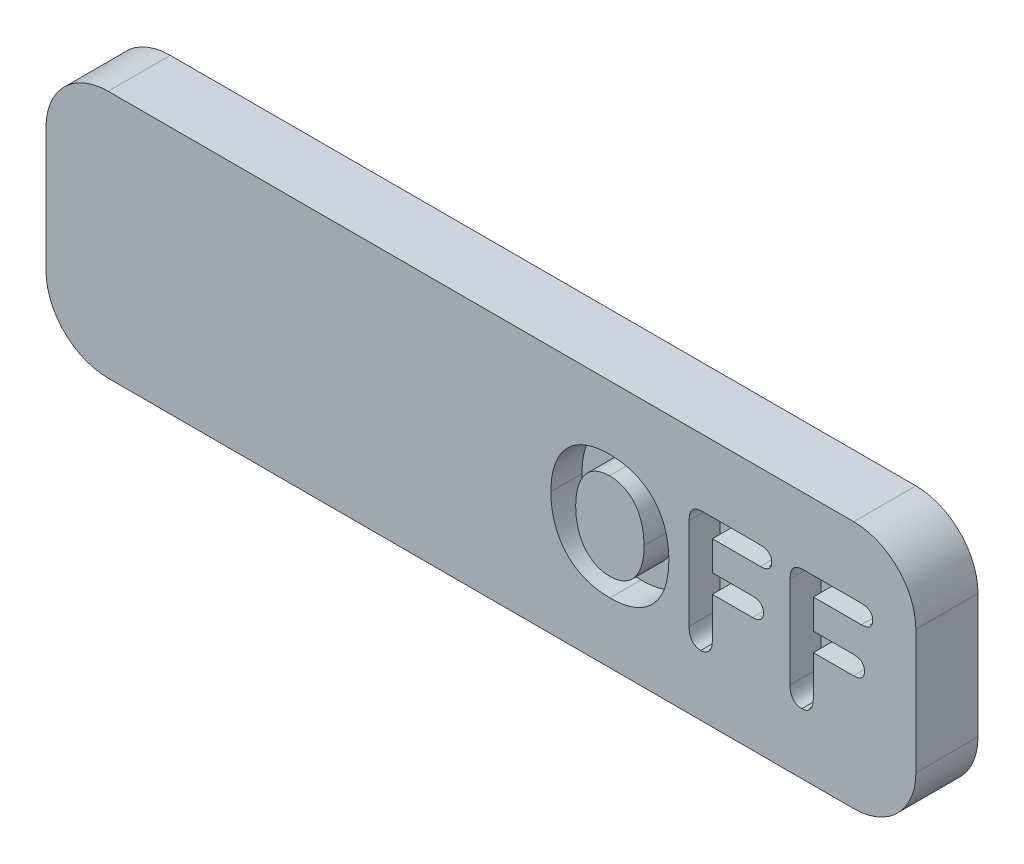
from build123d import *

# Parameters (mm, degrees)
AUFSATZ_LINEAR_AUSTRAGEN1_DEPTH = 1
SCHNITT_LINEAR_AUSTRAGEN1_DEPTH = 0.5


with BuildPart() as part:
    # Skizze1 → Aufsatz-Linear austragen1 (new body)
    with BuildSketch(Plane.XY):
        with BuildLine():
            Line((1, 0), (13, 0))
            ThreePointArc((13, 0), (13.707106781, 0.292893219), (14, 1))
            Line((14, 1), (14, 3))
            ThreePointArc((14, 3), (13.707106781, 3.707106781), (13, 4))
            Line((13, 4), (1, 4))
            ThreePointArc((1, 4), (0.292893219, 3.707106781), (0, 3))
            Line((0, 3), (0, 1))
            ThreePointArc((0, 1), (0.292893219, 0.292893219), (1, 0))
        make_face()
    extrude(amount=AUFSATZ_LINEAR_AUSTRAGEN1_DEPTH)

    # Skizze2 → Schnitt-Linear austragen1 (cut)
    # profile 1 of 3: a face of its own
    with BuildSketch(Plane.XY.offset(1)):
        with BuildLine():
            add(Edge.make_bspline(
                [(9.068359375, 2.975), (9.093112394, 2.974652516), (9.14164836, 2.973971167), (9.213088792, 2.96779492), (9.281989676, 2.95862748), (9.348304365, 2.945431971), (9.411868349, 2.928213747), (9.472693733, 2.90705225), (9.530858895, 2.882017573), (9.586431863, 2.853600887), (9.638802164, 2.821433292), (9.688303235, 2.786256364), (9.73437439, 2.747554036), (9.77712302, 2.705666037), (9.816276383, 2.660478074), (9.852403686, 2.612241049), (9.885226635, 2.56068362), (9.914391718, 2.505816744), (9.940594574, 2.44846024), (9.963340406, 2.388446006), (9.982324979, 2.326028293), (9.998116048, 2.26110371), (10.010084082, 2.193767278), (10.018514176, 2.123861297), (10.024350356, 2.051661497), (10.024781349, 2.002616087), (10.025, 1.977734375)],
                knots=[0, 0, 0, 0, 1.137132438, 2.22970057, 3.292424762, 4.329649132, 5.333981859, 6.315987487, 7.286185149, 8.241436353, 9.181332131, 10.107725602, 11.0292572, 11.943085262, 12.854854597, 13.773819033, 14.709898734, 15.660115542, 16.626635295, 17.605574315, 18.606712189, 19.622473761, 20.67399022, 21.747038223, 22.857027702, 24, 24, 24, 24], degree=3))
            add(Edge.make_bspline(
                [(10.025, 1.977734375), (10.024236943, 1.941248344), (10.022739737, 1.869658489), (10.011382941, 1.76485224), (9.992130943, 1.66508578), (9.965911152, 1.570399581), (9.931448688, 1.481449161), (9.889521373, 1.398351336), (9.839716722, 1.321507209), (9.782571307, 1.250986245), (9.718303636, 1.18718792), (9.646474639, 1.13157047), (9.567529745, 1.084100864), (9.48217021, 1.044116269), (9.38988477, 1.012613038), (9.290860282, 0.991433257), (9.185708374, 0.977018048), (9.11333274, 0.975684634), (9.076171875, 0.975)],
                knots=[0, 0, 0, 0, 1.119700056, 2.196982321, 3.230778928, 4.235358115, 5.208318876, 6.153781848, 7.087131445, 8.013361148, 8.934611457, 9.860297843, 10.794468433, 11.756326826, 12.748403726, 13.780058436, 14.860183413, 16, 16, 16, 16], degree=3))
            add(Edge.make_bspline(
                [(9.076171875, 0.975), (9.03927875, 0.975888232), (8.967053764, 0.977627108), (8.861766869, 0.991561146), (8.762215291, 1.013976035), (8.668967416, 1.04602514), (8.582674595, 1.08683826), (8.502975001, 1.134344554), (8.431414901, 1.190464862), (8.367075118, 1.253597267), (8.309960779, 1.323841341), (8.261404629, 1.401545242), (8.218582067, 1.485017774), (8.184733705, 1.575497068), (8.157803717, 1.671020204), (8.13882396, 1.770875151), (8.127251689, 1.874465923), (8.125758488, 1.944761386), (8.125, 1.98046875)],
                knots=[0, 0, 0, 0, 1.130091603, 2.212359386, 3.247930852, 4.252250901, 5.226719473, 6.16821431, 7.089197795, 8.00610207, 8.925165125, 9.855999165, 10.808795857, 11.79501972, 12.810514548, 13.846493258, 14.906102224, 16, 16, 16, 16], degree=3))
            add(Edge.make_bspline(
                [(8.125, 1.98046875), (8.125688028, 2.016832883), (8.127040936, 2.088337779), (8.139531744, 2.193099625), (8.15925301, 2.293397724), (8.187362441, 2.388727145), (8.223002781, 2.478418194), (8.266262664, 2.561492737), (8.316348518, 2.637693274), (8.373591781, 2.70687478), (8.438083357, 2.768616063), (8.509462446, 2.82261175), (8.587377693, 2.86905948), (8.671832678, 2.907263474), (8.762443164, 2.937927219), (8.859185583, 2.959576748), (8.961878055, 2.97269235), (9.032251673, 2.974217478), (9.068359375, 2.975)],
                knots=[0, 0, 0, 0, 1.125218611, 2.212582392, 3.260701818, 4.286054269, 5.284468473, 6.243521648, 7.180287843, 8.101949555, 9.017004541, 9.937572836, 10.866572707, 11.818894766, 12.801573564, 13.82236102, 14.882684417, 16, 16, 16, 16], degree=3))
        make_face()
        with BuildLine():
            add(Edge.make_bspline(
                [(9.625, 1.98046875), (9.624236115, 2.015277472), (9.622757058, 2.082675226), (9.609648511, 2.180171038), (9.588416712, 2.27060321), (9.563111057, 2.340625009), (9.538811369, 2.392528468), (9.51896586, 2.42865343), (9.497617935, 2.462663361), (9.473388511, 2.493425176), (9.448255174, 2.522406317), (9.421043849, 2.54892338), (9.391707134, 2.572581535), (9.350596581, 2.601296683), (9.295234429, 2.631050621), (9.223753123, 2.656546627), (9.147556711, 2.672258276), (9.09512819, 2.674073293), (9.068359375, 2.675)],
                knots=[0, 0, 0, 0, 1.663767962, 3.22144036, 4.693807908, 6.09809827, 6.772124886, 7.43249818, 8.068074837, 8.689496673, 9.30272399, 9.901527182, 10.503429657, 11.102750509, 12.297797107, 13.495176895, 14.721094103, 16, 16, 16, 16], degree=3))
            add(Edge.make_bspline(
                [(9.068359375, 2.675), (9.04918449, 2.674523021), (9.011287158, 2.673580316), (8.955655243, 2.664627547), (8.902215528, 2.650626376), (8.851216647, 2.631043473), (8.803112784, 2.606035103), (8.758119138, 2.575673263), (8.716778265, 2.540076152), (8.678858763, 2.499387916), (8.64458724, 2.453198562), (8.614182017, 2.401028966), (8.587690016, 2.342878426), (8.565104568, 2.279265806), (8.547241689, 2.210518214), (8.534540277, 2.137356433), (8.526561269, 2.060201883), (8.525528163, 2.007441739), (8.525, 1.98046875)],
                knots=[0, 0, 0, 0, 0.926902171, 1.831933723, 2.71800685, 3.595261319, 4.468550136, 5.334998465, 6.214894287, 7.1017058, 8.020008637, 8.99111482, 10.01694856, 11.106630737, 12.25237115, 13.448355624, 14.695502513, 16, 16, 16, 16], degree=3))
            add(Edge.make_bspline(
                [(8.525, 1.98046875), (8.525529621, 1.953235833), (8.526565779, 1.899956987), (8.534528502, 1.822019496), (8.547312827, 1.74796955), (8.565048146, 1.678113625), (8.58799262, 1.613266121), (8.615536195, 1.554021234), (8.646413772, 1.499956378), (8.682840272, 1.452579062), (8.722186978, 1.410770889), (8.76447307, 1.374356244), (8.809393417, 1.343334803), (8.857378179, 1.318080366), (8.908164293, 1.299131658), (8.961190349, 1.284770984), (9.016800589, 1.276568573), (9.054661701, 1.275527183), (9.073828125, 1.275)],
                knots=[0, 0, 0, 0, 1.300369924, 2.54406124, 3.737115199, 4.88637188, 5.981883645, 7.016846829, 8.003376514, 8.948590554, 9.863559023, 10.741055788, 11.608647785, 12.46534091, 13.323432129, 14.192248925, 15.0848625, 16, 16, 16, 16], degree=3))
            add(Edge.make_bspline(
                [(9.073828125, 1.275), (9.098514049, 1.275826804), (9.147153697, 1.277455889), (9.218375005, 1.292666561), (9.286422084, 1.316581814), (9.340300617, 1.34411813), (9.380907534, 1.371243102), (9.410251531, 1.394127245), (9.437531132, 1.420168305), (9.463533565, 1.448361043), (9.487628227, 1.479320201), (9.510440944, 1.51265316), (9.531503359, 1.54871627), (9.550989754, 1.587307904), (9.568587312, 1.628357856), (9.583936454, 1.67175711), (9.596172475, 1.717696454), (9.606851743, 1.765749251), (9.614975974, 1.816231574), (9.620753103, 1.868901619), (9.624372846, 1.923907557), (9.624787704, 1.961322387), (9.625, 1.98046875)],
                knots=[0, 0, 0, 0, 1.468568495, 2.893578421, 4.316075305, 5.755382189, 6.482330971, 7.222315454, 7.968369796, 8.725783183, 9.504530818, 10.302500265, 11.129737207, 11.9897977, 12.875655565, 13.787998707, 14.728608307, 15.705132475, 16.718642732, 17.771954593, 18.859838044, 20, 20, 20, 20], degree=3))
        make_face(mode=Mode.SUBTRACT)
    # profile 2 of 3: a face of its own
    with BuildSketch(Plane.XY.offset(1)):
        with BuildLine():
            Line((11.496484375, 2.625), (10.725, 2.625))
            Line((10.725, 2.625), (10.725, 2.15))
            Line((10.725, 2.15), (11.369921875, 2.15))
            add(Edge.make_bspline(
                [(11.369921875, 2.15), (11.383883271, 2.14945879), (11.410203576, 2.148438491), (11.447110821, 2.141389144), (11.47840524, 2.128371341), (11.504035903, 2.110243318), (11.523463113, 2.087261174), (11.537856979, 2.061180563), (11.546289753, 2.031234647), (11.547187079, 2.010211048), (11.54765625, 1.99921875)],
                knots=[0, 0, 0, 0, 1.26669481, 2.387998457, 3.388485007, 4.319542635, 5.207485584, 6.095585677, 7.004267047, 8, 8, 8, 8], degree=3))
            add(Edge.make_bspline(
                [(11.54765625, 1.99921875), (11.547225036, 1.988341658), (11.546394154, 1.967383214), (11.53731942, 1.937748985), (11.523249102, 1.911450225), (11.503180899, 1.889110295), (11.47762874, 1.871144254), (11.446294386, 1.858913112), (11.40990744, 1.850884055), (11.383773158, 1.850306243), (11.369921875, 1.85)],
                knots=[0, 0, 0, 0, 0.989228558, 1.906087716, 2.798941975, 3.690531566, 4.619691956, 5.620966574, 6.739101907, 8, 8, 8, 8], degree=3))
            Line((11.369921875, 1.85), (10.725, 1.85))
            Line((10.725, 1.85), (10.725, 1.213671875))
            add(Edge.make_bspline(
                [(10.725, 1.213671875), (10.724507022, 1.194743935), (10.723577977, 1.159073102), (10.714003189, 1.109381119), (10.697818889, 1.067102991), (10.674221588, 1.033239862), (10.645873511, 1.006936107), (10.613099687, 0.988678385), (10.577002457, 0.976625506), (10.551401537, 0.975550786), (10.53828125, 0.975)],
                knots=[0, 0, 0, 0, 1.324745361, 2.496561692, 3.52818871, 4.472071426, 5.363073267, 6.212819431, 7.084082786, 8, 8, 8, 8], degree=3))
            add(Edge.make_bspline(
                [(10.53828125, 0.975), (10.524898438, 0.975537353), (10.498908347, 0.97658092), (10.462322489, 0.988691755), (10.429172604, 1.006807308), (10.400823857, 1.033266589), (10.377052726, 1.067005945), (10.361814323, 1.109182644), (10.351161808, 1.15793295), (10.350403718, 1.193028678), (10.35, 1.21171875)],
                knots=[0, 0, 0, 0, 0.935462148, 1.816714299, 2.675664794, 3.567975675, 4.513245122, 5.543029804, 6.691551627, 8, 8, 8, 8], degree=3))
            Line((10.35, 1.21171875), (10.35, 2.687109375))
            add(Edge.make_bspline(
                [(10.35, 2.687109375), (10.350303969, 2.700402832), (10.350883848, 2.725762591), (10.355120221, 2.762019314), (10.362274965, 2.794479223), (10.372904114, 2.823173536), (10.386761337, 2.848253735), (10.403797605, 2.870134329), (10.425248409, 2.887380518), (10.449323701, 2.901829451), (10.477228128, 2.912064534), (10.508196329, 2.920067086), (10.542867304, 2.924052122), (10.567049713, 2.92467466), (10.5796875, 2.925)],
                knots=[0, 0, 0, 0, 1.248307341, 2.381380143, 3.422634109, 4.362988604, 5.244318775, 6.105654139, 6.948029729, 7.814212849, 8.731706968, 9.728269157, 10.812787817, 12, 12, 12, 12], degree=3))
            Line((10.5796875, 2.925), (11.496484375, 2.925))
            add(Edge.make_bspline(
                [(11.496484375, 2.925), (11.511092234, 2.92445922), (11.538439133, 2.923446843), (11.576855611, 2.916484187), (11.609045432, 2.903005621), (11.635633047, 2.884905722), (11.655629615, 2.862131446), (11.670819949, 2.836454099), (11.679453653, 2.807048707), (11.680382788, 2.786381969), (11.680859375, 2.77578125)],
                knots=[0, 0, 0, 0, 1.306215152, 2.44532304, 3.467849054, 4.404266228, 5.294549162, 6.155037916, 7.053652051, 8, 8, 8, 8], degree=3))
            add(Edge.make_bspline(
                [(11.680859375, 2.77578125), (11.680401401, 2.764914553), (11.679513686, 2.74385102), (11.670702961, 2.713899719), (11.655888245, 2.687581141), (11.635591812, 2.664748454), (11.60914249, 2.646514501), (11.576747722, 2.633642883), (11.538457102, 2.62651146), (11.51109849, 2.625526262), (11.496484375, 2.625)],
                knots=[0, 0, 0, 0, 0.963504472, 1.867615256, 2.742849562, 3.627587234, 4.558171791, 5.569908026, 6.701920807, 8, 8, 8, 8], degree=3))
        make_face()
    # profile 3 of 3: a face of its own
    with BuildSketch(Plane.XY.offset(1)):
        with BuildLine():
            Line((13.121484375, 2.625), (12.35, 2.625))
            Line((12.35, 2.625), (12.35, 2.15))
            Line((12.35, 2.15), (12.994921875, 2.15))
            add(Edge.make_bspline(
                [(12.994921875, 2.15), (13.008883271, 2.14945879), (13.035203576, 2.148438491), (13.072110821, 2.141389144), (13.10340524, 2.128371341), (13.129035903, 2.110243318), (13.148463113, 2.087261174), (13.162856979, 2.061180563), (13.171289753, 2.031234647), (13.172187079, 2.010211048), (13.17265625, 1.99921875)],
                knots=[0, 0, 0, 0, 1.26669481, 2.387998457, 3.388485007, 4.319542635, 5.207485584, 6.095585677, 7.004267047, 8, 8, 8, 8], degree=3))
            add(Edge.make_bspline(
                [(13.17265625, 1.99921875), (13.172225036, 1.988341658), (13.171394154, 1.967383214), (13.16231942, 1.937748985), (13.148249102, 1.911450225), (13.128180899, 1.889110295), (13.10262874, 1.871144254), (13.071294386, 1.858913112), (13.03490744, 1.850884055), (13.008773158, 1.850306243), (12.994921875, 1.85)],
                knots=[0, 0, 0, 0, 0.989228558, 1.906087716, 2.798941975, 3.690531566, 4.619691956, 5.620966574, 6.739101907, 8, 8, 8, 8], degree=3))
            Line((12.994921875, 1.85), (12.35, 1.85))
            Line((12.35, 1.85), (12.35, 1.213671875))
            add(Edge.make_bspline(
                [(12.35, 1.213671875), (12.349507022, 1.194743935), (12.348577977, 1.159073102), (12.339003189, 1.109381119), (12.322818889, 1.067102991), (12.299221588, 1.033239862), (12.270873511, 1.006936107), (12.238099687, 0.988678385), (12.202002457, 0.976625506), (12.176401537, 0.975550786), (12.16328125, 0.975)],
                knots=[0, 0, 0, 0, 1.324745361, 2.496561692, 3.52818871, 4.472071426, 5.363073267, 6.212819431, 7.084082786, 8, 8, 8, 8], degree=3))
            add(Edge.make_bspline(
                [(12.16328125, 0.975), (12.149898438, 0.975537353), (12.123908347, 0.97658092), (12.087322489, 0.988691755), (12.054172604, 1.006807308), (12.025823857, 1.033266589), (12.002052726, 1.067005945), (11.986814323, 1.109182644), (11.976161808, 1.15793295), (11.975403718, 1.193028678), (11.975, 1.21171875)],
                knots=[0, 0, 0, 0, 0.935462148, 1.816714299, 2.675664794, 3.567975675, 4.513245122, 5.543029804, 6.691551627, 8, 8, 8, 8], degree=3))
            Line((11.975, 1.21171875), (11.975, 2.687109375))
            add(Edge.make_bspline(
                [(11.975, 2.687109375), (11.975303969, 2.700402832), (11.975883848, 2.725762591), (11.980120221, 2.762019314), (11.987274965, 2.794479223), (11.997904114, 2.823173536), (12.011761337, 2.848253735), (12.028797605, 2.870134329), (12.050248409, 2.887380518), (12.074323701, 2.901829451), (12.102228128, 2.912064534), (12.133196329, 2.920067086), (12.167867304, 2.924052122), (12.192049713, 2.92467466), (12.2046875, 2.925)],
                knots=[0, 0, 0, 0, 1.248307341, 2.381380143, 3.422634109, 4.362988604, 5.244318775, 6.105654139, 6.948029729, 7.814212849, 8.731706968, 9.728269157, 10.812787817, 12, 12, 12, 12], degree=3))
            Line((12.2046875, 2.925), (13.121484375, 2.925))
            add(Edge.make_bspline(
                [(13.121484375, 2.925), (13.136092234, 2.92445922), (13.163439133, 2.923446843), (13.201855611, 2.916484187), (13.234045432, 2.903005621), (13.260633047, 2.884905722), (13.280629615, 2.862131446), (13.295819949, 2.836454099), (13.304453653, 2.807048707), (13.305382788, 2.786381969), (13.305859375, 2.77578125)],
                knots=[0, 0, 0, 0, 1.306215152, 2.44532304, 3.467849054, 4.404266228, 5.294549162, 6.155037916, 7.053652051, 8, 8, 8, 8], degree=3))
            add(Edge.make_bspline(
                [(13.305859375, 2.77578125), (13.305401401, 2.764914553), (13.304513686, 2.74385102), (13.295702961, 2.713899719), (13.280888245, 2.687581141), (13.260591812, 2.664748454), (13.23414249, 2.646514501), (13.201747722, 2.633642883), (13.163457102, 2.62651146), (13.13609849, 2.625526262), (13.121484375, 2.625)],
                knots=[0, 0, 0, 0, 0.963504472, 1.867615256, 2.742849562, 3.627587234, 4.558171791, 5.569908026, 6.701920807, 8, 8, 8, 8], degree=3))
        make_face()
    extrude(amount=-SCHNITT_LINEAR_AUSTRAGEN1_DEPTH, mode=Mode.SUBTRACT)


solid = part.part
